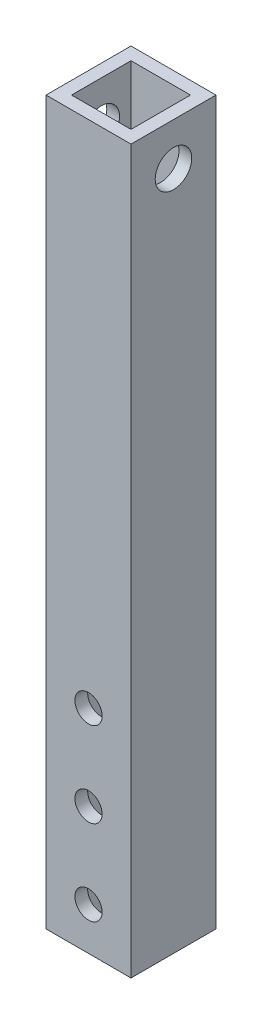
from build123d import *

# Parameters (mm, degrees)
SKETCH_1_W          = 10
SKETCH_1_H          = 10
SKETCH_1_W_2        = 7
SKETCH_1_H_2        = 7
EXTRUDE_1_DEPTH     = 85
SKETCH_2_R          = 1.6
CUT_EXTRUDE_1_DEPTH = 86.732140997
SKETCH_3_R          = 2.15
CUT_EXTRUDE_2_DEPTH = 86.732140997


with BuildPart() as part:
    # ｽｹｯﾁ1 → 押し出し-薄板1 (new body)
    with BuildSketch(Plane(origin=(0, 0, 0), x_dir=(1, 0, 0), z_dir=(0, 1, 0))):
        Rectangle(SKETCH_1_W, SKETCH_1_H)
        Rectangle(SKETCH_1_W_2, SKETCH_1_H_2, mode=Mode.SUBTRACT)
    extrude(amount=EXTRUDE_1_DEPTH)

    # ｽｹｯﾁ2 → ｶｯﾄ - 押し出し1 (cut, through all)
    with BuildSketch(Plane.XY.offset(5)):
        with Locations((0, 25)):
            Circle(SKETCH_2_R)
        with Locations((0, 5)):
            Circle(SKETCH_2_R)
        with Locations((0, 15)):
            Circle(SKETCH_2_R)
    extrude(amount=-CUT_EXTRUDE_1_DEPTH, mode=Mode.SUBTRACT)

    # ｽｹｯﾁ3 → ｶｯﾄ - 押し出し2 (cut, through all)
    with BuildSketch(Plane(origin=(5, 0, 0), x_dir=(0, 0, -1), z_dir=(1, 0, 0))):
        with Locations((0, 80)):
            Circle(SKETCH_3_R)
    extrude(amount=-CUT_EXTRUDE_2_DEPTH, mode=Mode.SUBTRACT)


solid = part.part
